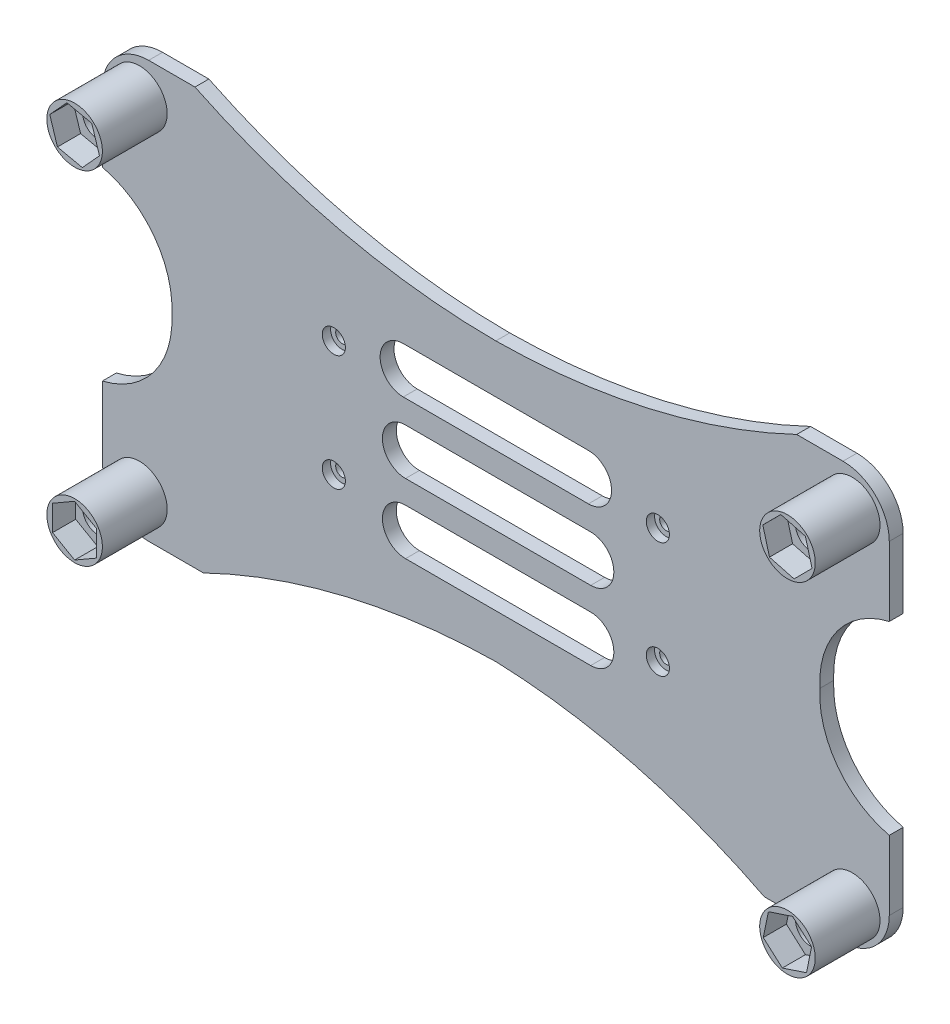
from build123d import *

# Parameters (mm, degrees)
EXTRUDE_1_DEPTH          = 3
CUT_EXTRUDE_1_DEPTH      = 42
CUT_EXTRUDE_1_DEPTH_BACK = 10
SKETCH_2_R               = 1.4
SKETCH_3_R               = 2.5
CUT_EXTRUDE_2_DEPTH      = 1.8
SKETCH_7_R               = 6
EXTRUDE_4_DEPTH          = 14
BUTTON_LEFT_NUT_DEPTH    = 5
UP_LEFT_NUT_DEPTH        = 5
UP_RIGHT_NUT_DEPTH       = 5
BUTTON_RIGHT_NUT_DEPTH   = 5
SKETCH_13_R              = 3.25
CUT_EXTRUDE_7_DEPTH      = 13
SKETCH_15_R              = 3.25
CUT_EXTRUDE_8_DEPTH      = 13
SKETCH_16_R              = 3.25
CUT_EXTRUDE_9_DEPTH      = 13
SKETCH_17_R              = 3.25
CUT_EXTRUDE_10_DEPTH     = 13


with BuildPart() as part:
    # 草图1 → 凸台-拉伸1 (new body)
    with BuildSketch(Plane.XY):
        with BuildLine():
            Line((-72.574116531, 45.487390308), (77.425883469, 45.487390308))
            ThreePointArc((77.425883469, 45.487390308), (84.496951281, 42.558458119), (87.425883469, 35.487390308))
            Line((87.425883469, 35.487390308), (87.425883469, -34.512609692))
            ThreePointArc((87.425883469, -34.512609692), (84.496951281, -41.583677504), (77.425883469, -44.512609692))
            Line((77.425883469, -44.512609692), (-72.574116531, -44.512609692))
            ThreePointArc((-72.574116531, -44.512609692), (-79.645184343, -41.583677504), (-82.574116531, -34.512609692))
            Line((-82.574116531, -34.512609692), (-82.574116531, 35.487390308))
            ThreePointArc((-82.574116531, 35.487390308), (-79.645184343, 42.558458119), (-72.574116531, 45.487390308))
        make_face()
    extrude(amount=EXTRUDE_1_DEPTH)

    # 草图2 → 切除-拉伸1 (cut, two sides: drawn at the far end of the back side and taken through both)
    with BuildSketch(Plane.XY.offset(3).offset(-CUT_EXTRUDE_1_DEPTH_BACK)):
        with Locations((-32.574116531, 12.987390308)):
            Circle(SKETCH_2_R)
        with Locations((-32.574116531, -12.012609692)):
            Circle(SKETCH_2_R)
        with Locations((37.425883469, 12.987390308)):
            Circle(SKETCH_2_R)
        with Locations((37.425883469, -12.012609692)):
            Circle(SKETCH_2_R)
        with BuildLine():
            Line((-60.749662301, -44.512609692), (60.437772164, -44.512609692))
            ThreePointArc((60.437772164, -44.512609692), (32.253211404, -33.835942142), (2.425883469, -29.512609692))
            ThreePointArc((2.425883469, -29.512609692), (-29.983273004, -33.55318593), (-60.749662301, -44.512609692))
        make_face()
        with BuildLine():
            Line((-62.574116531, 45.487390308), (67.425883469, 45.487390308))
            ThreePointArc((67.425883469, 45.487390308), (35.747267057, 34.428061428), (2.425883469, 30.487390308))
            ThreePointArc((2.425883469, 30.487390308), (-30.918540876, 34.328218147), (-62.574116531, 45.487390308))
        make_face()
        with BuildLine():
            Line((87.425883469, 20.487390308), (87.425883469, -19.512609692))
            ThreePointArc((87.425883469, -19.512609692), (76.286181126, -12.242386449), (72.425883469, 0.487390308))
            ThreePointArc((72.425883469, 0.487390308), (76.286181126, 13.217167065), (87.425883469, 20.487390308))
        make_face()
        with BuildLine():
            Line((-82.574116531, 20.487390308), (-82.574116531, -19.512609692))
            ThreePointArc((-82.574116531, -19.512609692), (-71.434414188, -12.242386449), (-67.574116531, 0.487390308))
            ThreePointArc((-67.574116531, 0.487390308), (-71.434414188, 13.217167065), (-82.574116531, 20.487390308))
        make_face()
        with BuildLine():
            Line((-17.574116531, 20), (22.425883469, 20))
            ThreePointArc((22.425883469, 20), (27.425883469, 15), (22.425883469, 10))
            Line((22.425883469, 10), (-17.574116531, 10))
            ThreePointArc((-17.574116531, 10), (-22.574116531, 15), (-17.574116531, 20))
        make_face()
        with BuildLine():
            Line((-17.079364826, 5), (22.920635174, 5))
            ThreePointArc((22.920635174, 5), (27.920635174, 0), (22.920635174, -5))
            Line((22.920635174, -5), (-17.079364826, -5))
            ThreePointArc((-17.079364826, -5), (-22.079364826, 0), (-17.079364826, 5))
        make_face()
        with BuildLine():
            Line((-17.079364826, -10), (22.920635174, -10))
            ThreePointArc((22.920635174, -10), (27.920635174, -15), (22.920635174, -20))
            Line((22.920635174, -20), (-17.079364826, -20))
            ThreePointArc((-17.079364826, -20), (-22.079364826, -15), (-17.079364826, -10))
        make_face()
    extrude(amount=CUT_EXTRUDE_1_DEPTH + CUT_EXTRUDE_1_DEPTH_BACK, mode=Mode.SUBTRACT)

    # 草图3 → 切除-拉伸2 (cut)
    with BuildSketch(Plane.XY.offset(3)):
        with Locations((-32.574116531, 12.987390308)):
            Circle(SKETCH_3_R)
        with Locations((37.425883469, 12.987390308)):
            Circle(SKETCH_3_R)
        with Locations((37.425883469, -12.012609692)):
            Circle(SKETCH_3_R)
        with Locations((-32.574116531, -12.012609692)):
            Circle(SKETCH_3_R)
    extrude(amount=-CUT_EXTRUDE_2_DEPTH, mode=Mode.SUBTRACT)

    # 草图7 → 凸台-拉伸4 (add)
    with BuildSketch(Plane.XY.offset(3)):
        with Locations(Location((-74.574116531, 37.487390308, 0), (0, 0, 180))):
            Circle(SKETCH_7_R)
        with Locations(Location((-74.574116531, -36.512609692, 0), (0, 0, 180))):
            Circle(SKETCH_7_R)
        with Locations(Location((79.425883469, 37.487390308, 0), (0, 0, 180))):
            Circle(SKETCH_7_R)
        with Locations(Location((79.425883469, -36.512609692, 0), (0, 0, 180))):
            Circle(SKETCH_7_R)
    extrude(amount=EXTRUDE_4_DEPTH)

    # 草图9 → button left nut (cut)
    with BuildSketch(Plane.XY.offset(17)):
        Polygon((-69.81097595, -39.262610189), (-69.81097595, -33.762609196), (-74.574116531, -31.0126087), (-79.337257112, -33.762609196), (-79.337257112, -39.262610189), (-74.574116531, -42.012610685), align=None)
    extrude(amount=-BUTTON_LEFT_NUT_DEPTH, mode=Mode.SUBTRACT)

    # 草图10 → up left nut (cut)
    with BuildSketch(Plane.XY.offset(17)):
        Polygon((-72.909327157, 32.245398669), (-69.202023918, 36.308144378), (-70.866813292, 41.550136017), (-76.238905905, 42.729381946), (-79.946209143, 38.666636237), (-78.28141977, 33.424644598), align=None)
    extrude(amount=-UP_LEFT_NUT_DEPTH, mode=Mode.SUBTRACT)

    # 草图11 → up right nut (cut)
    with BuildSketch(Plane.XY.offset(17)):
        Polygon((80.859330276, 32.177472205), (84.741130841, 36.073832606), (83.307684034, 41.383750708), (77.992436662, 42.79730841), (74.110636097, 38.900948009), (75.544082904, 33.591029907), align=None)
    extrude(amount=-UP_RIGHT_NUT_DEPTH, mode=Mode.SUBTRACT)

    # 草图12 → button right nut (cut)
    with BuildSketch(Plane.XY.offset(17)):
        Polygon((83.536634722, -40.166610806), (84.645716885, -34.779595236), (80.534965632, -31.125594122), (75.315132216, -32.858608579), (74.206050053, -38.245624149), (78.316801306, -41.899625263), align=None)
    extrude(amount=-BUTTON_RIGHT_NUT_DEPTH, mode=Mode.SUBTRACT)

    # 草图13 → 切除-拉伸7 (cut)
    with BuildSketch(Plane.XY.offset(17)):
        with Locations((-74.574116531, -36.512609692)):
            Circle(SKETCH_13_R)
    extrude(amount=-CUT_EXTRUDE_7_DEPTH, mode=Mode.SUBTRACT)

    # 草图15 → 切除-拉伸8 (cut)
    with BuildSketch(Plane.XY.offset(17)):
        with Locations((-74.574116531, 37.487390308)):
            Circle(SKETCH_15_R)
    extrude(amount=-CUT_EXTRUDE_8_DEPTH, mode=Mode.SUBTRACT)

    # 草图16 → 切除-拉伸9 (cut)
    with BuildSketch(Plane.XY.offset(17)):
        with Locations((79.425883469, 37.487390308)):
            Circle(SKETCH_16_R)
    extrude(amount=-CUT_EXTRUDE_9_DEPTH, mode=Mode.SUBTRACT)

    # 草图17 → 切除-拉伸10 (cut)
    with BuildSketch(Plane.XY.offset(17)):
        with Locations((79.425883469, -36.512609692)):
            Circle(SKETCH_17_R)
    extrude(amount=-CUT_EXTRUDE_10_DEPTH, mode=Mode.SUBTRACT)


solid = part.part
